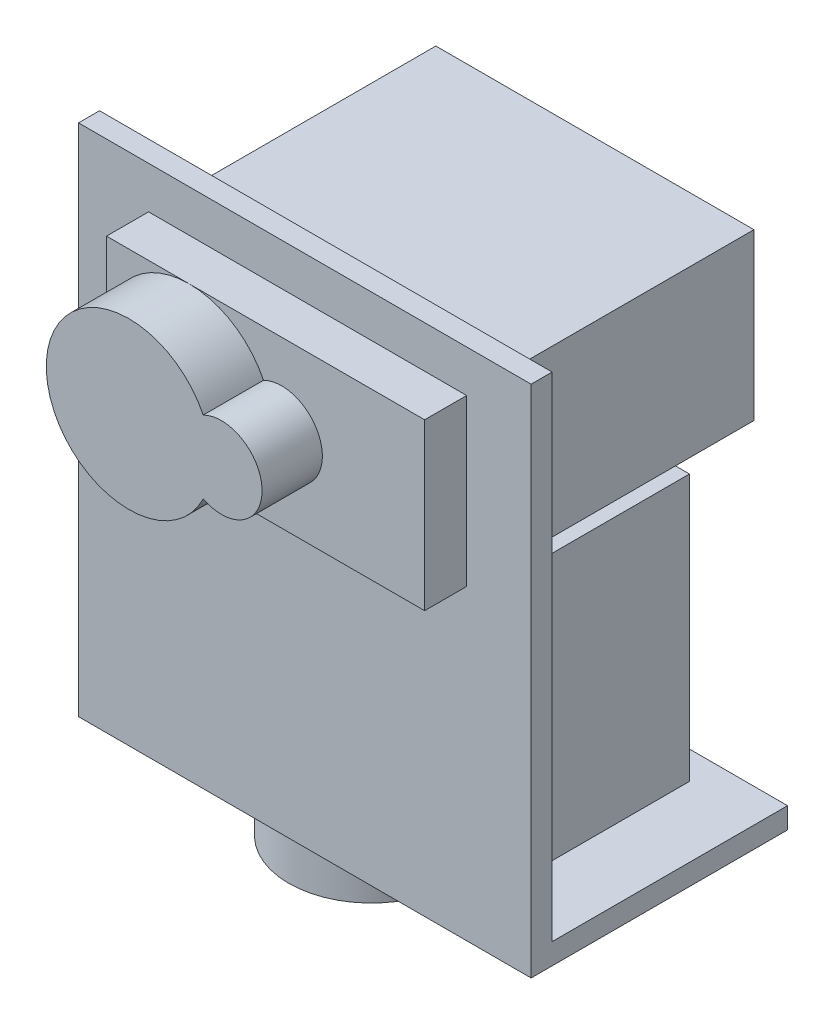
from build123d import *

# Parameters (mm, degrees)
SKETCH1_W           = 32.3
SKETCH1_H           = 36.7
BOSS_EXTRUDE1_DEPTH = 1.5
SKETCH2_W           = 32.3
SKETCH2_H           = 1.5
BOSS_EXTRUDE2_DEPTH = 16.8
SKETCH3_W           = 22.7
SKETCH3_H           = 11.8
BOSS_EXTRUDE3_DEPTH = 3
SKETCH4_R           = 5.9
BOSS_EXTRUDE4_DEPTH = 4.3
SKETCH7_W           = 22.7
SKETCH7_H           = 11.8
BOSS_EXTRUDE6_DEPTH = 3
SKETCH9_R           = 5.9
BOSS_EXTRUDE7_DEPTH = 4.3
BOSS_EXTRUDE8_START = -1.5
SKETCH7_2_W         = 22.7
SKETCH7_2_H         = 11.8
BOSS_EXTRUDE8_DEPTH = 19
BOSS_EXTRUDE9_START = -20.5
SKETCH3_2_W         = 22.7
SKETCH3_2_H         = 11.8
BOSS_EXTRUDE9_DEPTH = 19


with BuildPart() as part:
    # Sketch1 → Boss-Extrude1 (new body)
    with BuildSketch(Plane.XY):
        Rectangle(SKETCH1_W, SKETCH1_H)
    extrude(amount=BOSS_EXTRUDE1_DEPTH)

    # Sketch2 → Boss-Extrude2 (add)
    with BuildSketch(Plane(origin=(0, 0, 0), x_dir=(-1, 0, 0), z_dir=(0, 0, -1))):
        with Locations((0, -17.6)):
            Rectangle(SKETCH2_W, SKETCH2_H)
    extrude(amount=BOSS_EXTRUDE2_DEPTH)

    # Sketch3 → Boss-Extrude3 (add)
    with BuildSketch(Plane.XZ.offset(18.35)):
        with Locations((-0.2, -8.9)):
            Rectangle(SKETCH3_W, SKETCH3_H)
    extrude(amount=BOSS_EXTRUDE3_DEPTH)

    # Sketch4 → Boss-Extrude4 (add)
    with BuildSketch(Plane.XZ.offset(21.35)):
        with BuildLine():
            ThreePointArc((-0.35, -6.307703721), (0.098043145, -7.56958653), (0.25, -8.9))
            ThreePointArc((0.25, -8.9), (0.098043145, -10.23041347), (-0.35, -11.492296279))
            ThreePointArc((-0.35, -11.492296279), (3.85, -8.9), (-0.35, -6.307703721))
        make_face()
        with Locations((-5.65, -8.9)):
            Circle(SKETCH4_R)
    extrude(amount=BOSS_EXTRUDE4_DEPTH)

    # Sketch7 → Boss-Extrude6 (add)
    with BuildSketch(Plane(origin=(-13.214346586, -22.528065204, 1.5), x_dir=(-1, 0, 0), z_dir=(0, 0, 1))):
        with Locations((-13.414346586, -31.978065204)):
            Rectangle(SKETCH7_W, SKETCH7_H)
    extrude(amount=BOSS_EXTRUDE6_DEPTH)

    # Sketch9 → Boss-Extrude7 (add)
    with BuildSketch(Plane(origin=(-13.214346586, -22.528065204, 4.5), x_dir=(-1, 0, 0), z_dir=(0, 0, 1))):
        with Locations((-7.964346586, -31.978065204)):
            Circle(SKETCH9_R)
        with BuildLine():
            ThreePointArc((-13.264346586, -34.570361484), (-13.864346586, -31.978065204), (-13.264346586, -29.385768925))
            ThreePointArc((-13.264346586, -29.385768925), (-17.464346586, -31.978065204), (-13.264346586, -34.570361484))
        make_face()
    extrude(amount=BOSS_EXTRUDE7_DEPTH)

    # Sketch7<2> → Boss-Extrude8 (add)
    with BuildSketch(Plane(origin=(-13.214346586, -22.528065204, 1.5), x_dir=(-1, 0, 0), z_dir=(0, 0, 1)).offset(BOSS_EXTRUDE8_START)):
        with Locations((-13.414346586, -31.978065204)):
            Rectangle(SKETCH7_2_W, SKETCH7_2_H)
    extrude(amount=-BOSS_EXTRUDE8_DEPTH)

    # Sketch3<2> → Boss-Extrude9 (add)
    with BuildSketch(Plane.XZ.offset(18.35).offset(BOSS_EXTRUDE9_START)):
        with Locations((-0.2, -8.9)):
            Rectangle(SKETCH3_2_W, SKETCH3_2_H)
    extrude(amount=BOSS_EXTRUDE9_DEPTH)


solid = part.part
